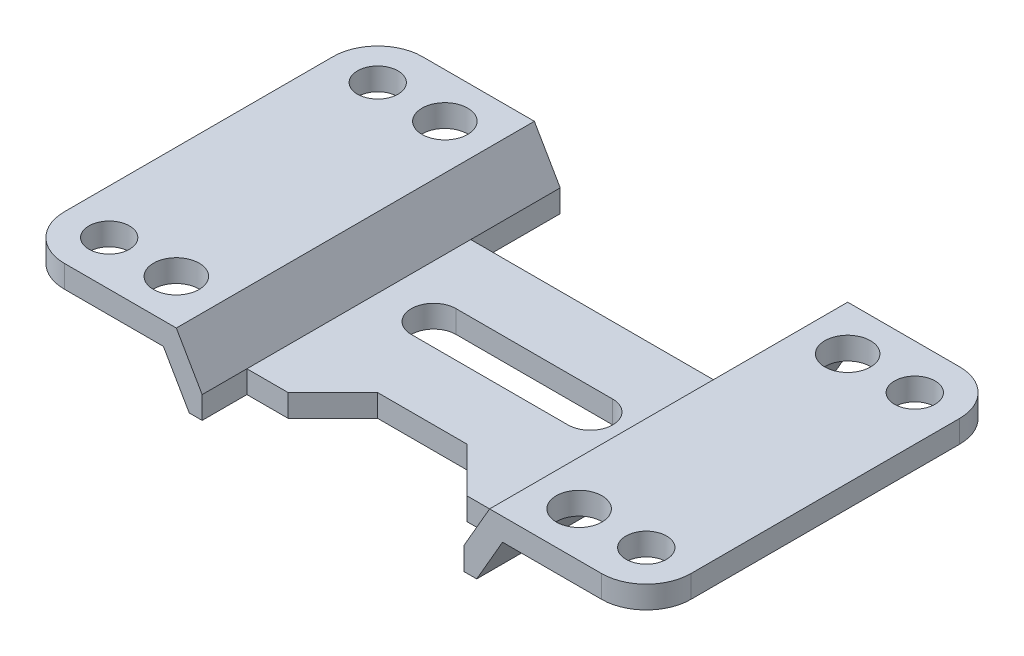
from build123d import *

# Parameters (mm, degrees)
BOSS_EXTRUDE1_DEPTH     = 50.8
SKETCH2_W               = 74.235303162
SKETCH2_H               = 25.4
CUT_EXTRUDE1_DEPTH      = 104.175287739
FILLET2_R               = 12.7
SKETCH4_R               = 6.477
CUT_EXTRUDE2_DEPTH      = 105.147743615
F_1_2_20_TAPPED_HOLE1_D = 11.50874


with BuildPart() as part:
    # Sketch1 → Boss-Extrude1 (new, symmetric)
    with BuildSketch(Plane.XY):
        Polygon((0, 0), (-37.117651581, 0), (-44.45, 12.7), (-88.9, 12.7), (-88.9, 6.35), (-48.116174209, 6.35), (-40.783825791, -6.35), (40.783825791, -6.35), (48.116174209, 6.35), (88.9, 6.35), (88.9, 12.7), (44.45, 12.7), (37.117651581, 0), align=None)
    extrude(amount=BOSS_EXTRUDE1_DEPTH, both=True)

    # Sketch2 → Cut-Extrude1 (cut, through all)
    with BuildSketch(Plane(origin=(0, 0, 0), x_dir=(1, 0, 0), z_dir=(0, 1, 0))):
        with Locations((0, 38.1)):
            Rectangle(SKETCH2_W, SKETCH2_H)
        Polygon((-37.117651581, -38.1), (-25.4, -38.1), (-12.7, -25.4), (12.7, -25.4), (25.4, -38.1), (37.117651581, -38.1), (37.117651581, -50.8), (-37.117651581, -50.8), align=None)
        with BuildLine():
            Line((-22.225, 6.35), (22.225, 6.35))
            ThreePointArc((22.225, 6.35), (28.575, 0), (22.225, -6.35))
            Line((22.225, -6.35), (-22.225, -6.35))
            ThreePointArc((-22.225, -6.35), (-28.575, 0), (-22.225, 6.35))
        make_face()
    extrude(amount=-CUT_EXTRUDE1_DEPTH, mode=Mode.SUBTRACT)

    # Fillet2
    fillet2_edges = [part.edges().sort_by_distance(p)[0] for p in [
        (88.9, 9.525, -50.8),
        (-88.9, 9.525, -50.8),
        (-88.9, 9.525, 50.8),
        (88.9, 9.525, 50.8),
    ]]
    fillet(fillet2_edges, radius=FILLET2_R)

    # Sketch4 → Cut-Extrude2 (cut, through all)
    with BuildSketch(Plane(origin=(0, 12.7, 0), x_dir=(1, 0, 0), z_dir=(0, 1, 0))):
        with Locations(Location((-57.15, 38.1, 0), (0, 0, 180))):
            Circle(SKETCH4_R)
        with Locations(Location((-57.15, -38.1, 0), (0, 0, 180))):
            Circle(SKETCH4_R)
        with Locations(Location((57.15, -38.1, 0), (0, 0, 180))):
            Circle(SKETCH4_R)
        with Locations(Location((57.15, 38.1, 0), (0, 0, 180))):
            Circle(SKETCH4_R)
    extrude(amount=-CUT_EXTRUDE2_DEPTH, mode=Mode.SUBTRACT)

    # 1/2-20 Tapped Hole1 (through all)
    with Locations(Plane(origin=(0, 12.7, 0), x_dir=(1, 0, 0), z_dir=(0, 1, 0))):
        with Locations((-76.2, 38.1), (-76.2, -38.1), (76.2, -38.1), (76.2, 38.1)):
            Hole(F_1_2_20_TAPPED_HOLE1_D / 2)


solid = part.part
